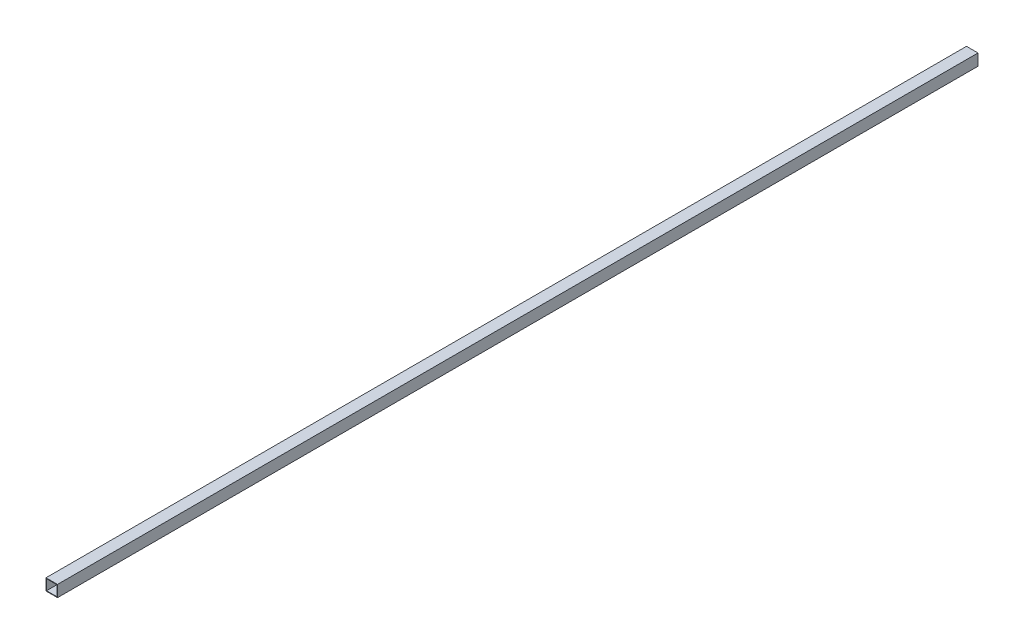
from build123d import *

# Parameters (mm, degrees)
SKETCH_1_W      = 20
SKETCH_1_H      = 20
SKETCH_1_W_2    = 18
SKETCH_1_H_2    = 18
EXTRUDE_1_DEPTH = 1600


with BuildPart() as part:
    # 草图1 → 凸台-拉伸1 (new body)
    with BuildSketch(Plane.XY):
        with Locations((10, 10)):
            Rectangle(SKETCH_1_W, SKETCH_1_H)
        with Locations((10, 10)):
            Rectangle(SKETCH_1_W_2, SKETCH_1_H_2, mode=Mode.SUBTRACT)
    extrude(amount=EXTRUDE_1_DEPTH)


solid = part.part
